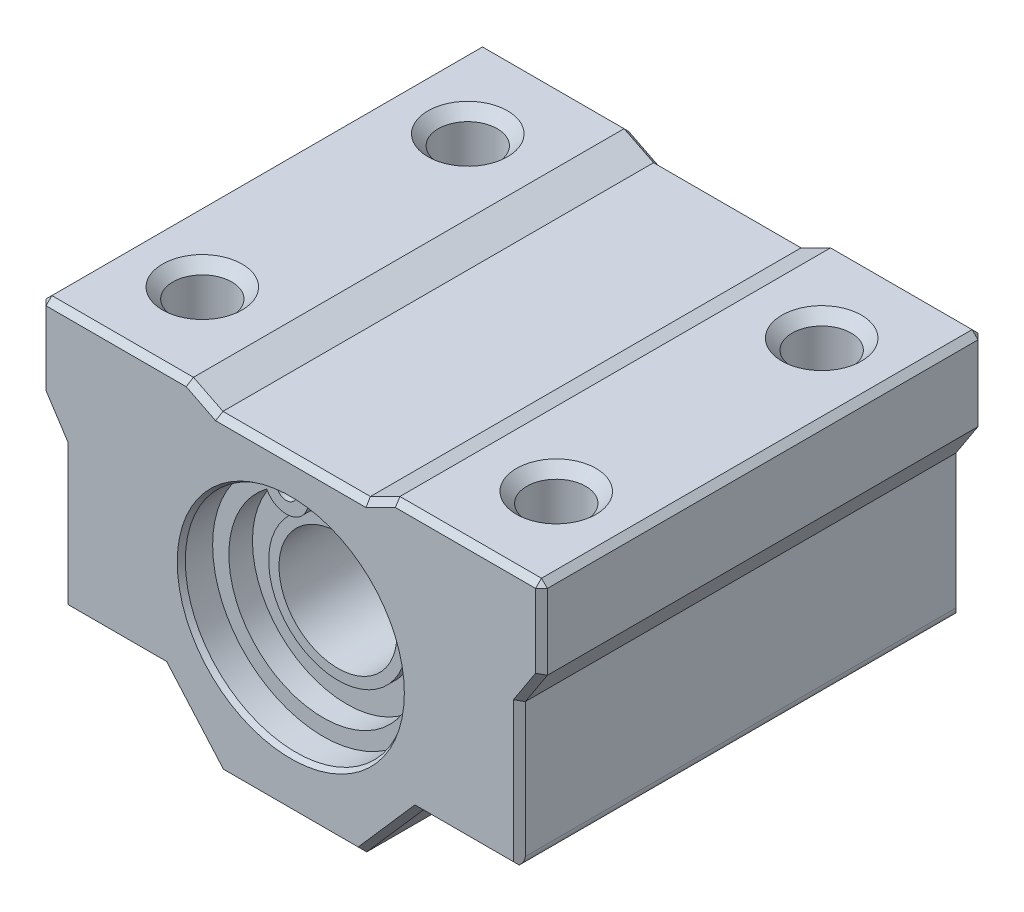
from build123d import *
from OCP.BRepFilletAPI import BRepFilletAPI_MakeChamfer

# Parameters (mm, degrees)
SKETCH1_R             = 7.5
BOSS_EXTRUDE1_DEPTH   = 15
SKETCH3_R             = 0.7
BOSS_EXTRUDE2_DEPTH   = 0.8
CHAFL_N0_SIZE         = 0.2
CHAFL_N0_SIZE2        = 0.346410162
CROQUIS1_R            = 2
CORTAR_EXTRUIR1_DEPTH = 20
CHAFL_N1_SIZE         = 0.7
CHAFL_N2_SIZE         = 0.4
REDONDEO1_R           = 0.7


with BuildPart() as part:
    # Sketch1 → Boss-Extrude1 (new, symmetric)
    with BuildSketch(Plane.XY):
        Polygon((-5, -1), (5, -1), (7, 0), (17, 0), (17, -5.5), (15.5, -7.8), (15.5, -17.6), (8.6, -17.6), (4.75, -22), (-4.75, -22), (-8.6, -17.6), (-15.5, -17.6), (-15.5, -7.8), (-17, -5.5), (-17, 0), (-7, 0), align=None)
        with Locations((0, -11)):
            Circle(SKETCH1_R, mode=Mode.SUBTRACT)
    extrude(amount=BOSS_EXTRUDE1_DEPTH, both=True)

    # Sketch2 → Revolve1 (revolve)
    with BuildSketch(Plane(origin=(0, 0, 0), x_dir=(0, 0, -1), z_dir=(1, 0, 0)), mode=Mode.PRIVATE) as revolve1_sk:
        Polygon((-12, -3.5), (12, -3.5), (12, -4.6), (11.2, -4.6), (11.2, -6.3), (11.8, -6.3), (11.8, -7), (-11.8, -7), (-11.8, -6.3), (-11.2, -6.3), (-11.2, -4.6), (-12, -4.6), align=None)
    revolve(revolve1_sk.sketch.rotate(Axis((0, -11, 30.2753079), (0, 0, -1)), 90), axis=Axis((0, -11, 30.2753079), (0, 0, -1)))

    # Sketch3 → Boss-Extrude2 (add)
    with BuildSketch(Plane.XY.offset(12)):
        with BuildLine():
            ThreePointArc((2, -3.771583853), (1.369159148, -6.17129169), (3.832579259, -5.874442838))
            ThreePointArc((3.832579259, -5.874442838), (0, -17.4), (-3.832579259, -5.874442838))
            ThreePointArc((-3.832579259, -5.874442838), (-1.369159148, -6.17129169), (-2, -3.771583853))
            ThreePointArc((-2, -3.771583853), (0, -18.5), (2, -3.771583853))
        make_face()
        with Locations(Location((2.5, -5.185797415, 0), (0, 0, 154.048310937))):
            Circle(SKETCH3_R, mode=Mode.SUBTRACT)
        with Locations(Location((-2.5, -5.185797415, 0), (0, 0, 180))):
            Circle(SKETCH3_R, mode=Mode.SUBTRACT)
    boss_extrude2 = extrude(amount=BOSS_EXTRUDE2_DEPTH)

    # simetria: Boss-Extrude2 across plane
    add(boss_extrude2.mirror(Plane.XY))

    # Chaflàn0: one chamfer whose edges measure the first distance from different faces: ONE call of the kernel's chamfer builder (chamfer() names one face for all edges)
    chafl_n0_edges_1 = [part.edges().sort_by_distance(p)[0] for p in [
        (-7.5, -11, -15),
    ]]
    chafl_n0_side_1 = [part.faces().sort_by_distance(p)[0] for p in [
        (-7.5, -11, -13.5),
    ]]
    chafl_n0_edges_2 = [part.edges().sort_by_distance(p)[0] for p in [
        (-7.5, -11, 15),
    ]]
    chafl_n0_side_2 = [part.faces().sort_by_distance(p)[0] for p in [
        (0, -1.404969135, 15),
    ]]
    chafl_n0 = BRepFilletAPI_MakeChamfer(part.part.solid().wrapped)
    for e in chafl_n0_edges_1:
        chafl_n0.Add(CHAFL_N0_SIZE, CHAFL_N0_SIZE2, e.wrapped, chafl_n0_side_1[0].wrapped)  # the first distance lies on this face
    for e in chafl_n0_edges_2:
        chafl_n0.Add(CHAFL_N0_SIZE, CHAFL_N0_SIZE2, e.wrapped, chafl_n0_side_2[0].wrapped)  # the first distance lies on this face
    add(Compound.cast(chafl_n0.Shape()), mode=Mode.REPLACE)

    # Croquis1 → Cortar-Extruir1 (cut)
    with BuildSketch(Plane(origin=(0, 0, 0), x_dir=(1, 0, 0), z_dir=(0, 1, 0))):
        with Locations(Location((-12, 9, 0), (0, 0, 180))):
            Circle(CROQUIS1_R)
        with Locations(Location((12, 9, 0), (0, 0, 180))):
            Circle(CROQUIS1_R)
        with Locations(Location((-12, -9, 0), (0, 0, 180))):
            Circle(CROQUIS1_R)
        with Locations(Location((12, -9, 0), (0, 0, 180))):
            Circle(CROQUIS1_R)
    extrude(amount=-CORTAR_EXTRUIR1_DEPTH, mode=Mode.SUBTRACT)

    # Chaflán1
    chafl_n1_edges = [part.edges().sort_by_distance(p)[0] for p in [
        (-10, -17.6, -9),
        (-10, 0, -9),
        (14, -17.6, -9),
        (14, 0, -9),
        (-10, -17.6, 9),
        (-10, 0, 9),
        (14, -17.6, 9),
        (14, 0, 9),
    ]]
    chamfer(chafl_n1_edges, length=CHAFL_N1_SIZE)

    # Chaflán2
    chafl_n2_edges = [part.edges().sort_by_distance(p)[0] for p in [
        (-6, -0.5, 15),
        (-12, 0, 15),
        (12, 0, -15),
        (17, -2.75, -15),
        (16.25, -6.65, -15),
        (15.5, -12.7, -15),
        (12.05, -17.6, -15),
        (-17, -2.75, 15),
        (6.675, -19.8, -15),
        (0, -22, -15),
        (-6.675, -19.8, -15),
        (-12.05, -17.6, -15),
        (-15.5, -12.7, -15),
        (-16.25, -6.65, -15),
        (-17, -2.75, -15),
        (-12, 0, -15),
        (-16.25, -6.65, 15),
        (-6, -0.5, -15),
        (0, -1, -15),
        (6, -0.5, -15),
        (-15.5, -12.7, 15),
        (-12.05, -17.6, 15),
        (17, 0, 0),
        (-17, 0, 0),
        (-6.675, -19.8, 15),
        (0, -22, 15),
        (6.675, -19.8, 15),
        (12.05, -17.6, 15),
        (6, -0.5, 15),
        (15.5, -12.7, 15),
        (16.25, -6.65, 15),
        (17, -2.75, 15),
        (12, 0, 15),
        (0, -1, 15),
    ]]
    chamfer(chafl_n2_edges, length=CHAFL_N2_SIZE)

    # Redondeo1
    redondeo1_edges = [part.edges().sort_by_distance(p)[0] for p in [
        (15.5, -17.6, 0),
        (-15.5, -17.6, 0),
    ]]
    fillet(redondeo1_edges, radius=REDONDEO1_R)


solid = part.part
